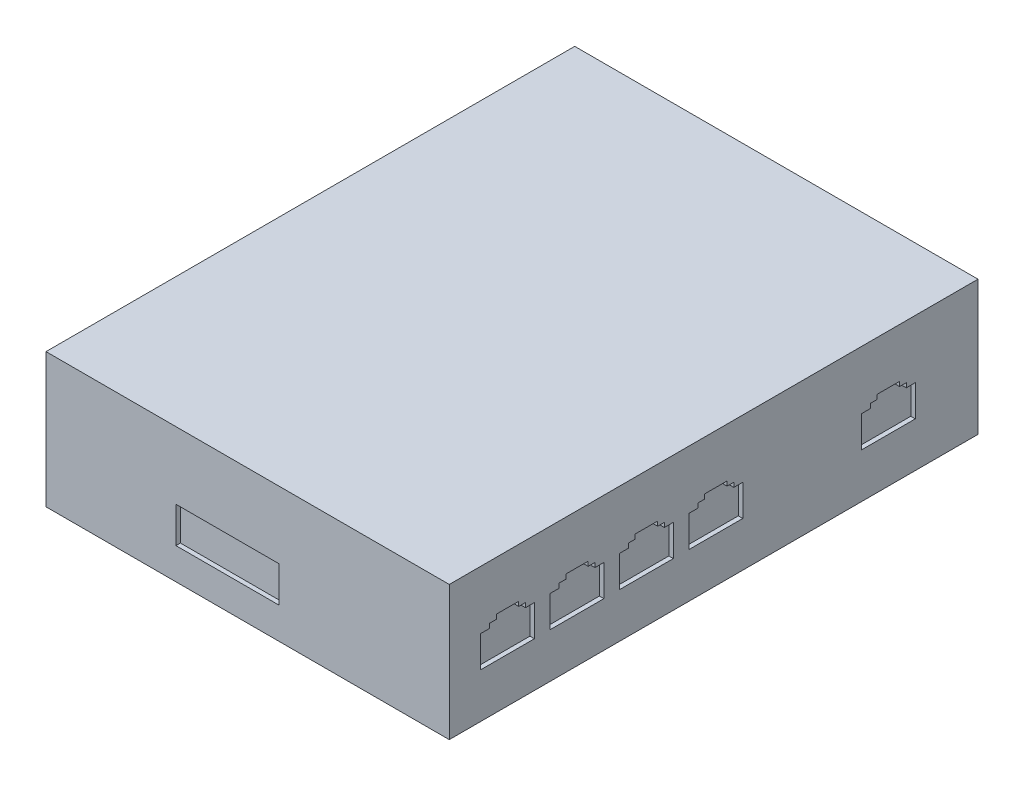
from build123d import *

# Parameters (mm, degrees)
SKETCH_1_W             = 90
SKETCH_1_H             = 118
EXTRUDE_1_DEPTH        = 30
HOLE_WIZARD_M3_1_D     = 2.5
HOLE_WIZARD_M3_1_DEPTH = 5
HOLE_WIZARD_M3_1_TIP   = 0.751075774
SKETCH_5_W             = 23
SKETCH_5_H             = 8
CUT_EXTRUDE_1_DEPTH    = 1
CUT_EXTRUDE_2_DEPTH    = 1


with BuildPart() as part:
    # 草图1 → 凸台-拉伸1 (new body)
    with BuildSketch(Plane(origin=(0, 0, 0), x_dir=(1, 0, 0), z_dir=(0, 1, 0))):
        Rectangle(SKETCH_1_W, SKETCH_1_H)
    extrude(amount=EXTRUDE_1_DEPTH)

    # M3 螺纹孔的螺纹孔钻头1
    with Locations(Plane.ZY.offset(45)):
        with Locations((10, 15), (-10, 15)):
            Hole(HOLE_WIZARD_M3_1_D / 2, depth=HOLE_WIZARD_M3_1_DEPTH)
            with Locations((0, 0, -(HOLE_WIZARD_M3_1_DEPTH + HOLE_WIZARD_M3_1_TIP / 2))):  # 118° drill point
                Cone(0, HOLE_WIZARD_M3_1_D / 2, HOLE_WIZARD_M3_1_TIP, mode=Mode.SUBTRACT)

    # 草图5 → 切除-拉伸1 (cut)
    with BuildSketch(Plane.XY.offset(59)):
        with Locations((-4.5, 11)):
            Rectangle(SKETCH_5_W, SKETCH_5_H)
    extrude(amount=-CUT_EXTRUDE_1_DEPTH, mode=Mode.SUBTRACT)

    # 草图6 → 切除-拉伸2 (cut)
    with BuildSketch(Plane(origin=(45, 0, 0), x_dir=(0, 0, -1), z_dir=(1, 0, 0))):
        Polygon((-40, 10), (-52, 10), (-52, 17), (-50, 17), (-50, 18), (-48.5, 18), (-48.5, 19), (-43.5, 19), (-43.5, 18), (-42, 18), (-42, 17), (-40, 17), align=None)
        Polygon((-24.5, 10), (-36.5, 10), (-36.5, 17), (-34.5, 17), (-34.5, 18), (-33, 18), (-33, 19), (-28, 19), (-28, 18), (-26.5, 18), (-26.5, 17), (-24.5, 17), align=None)
        Polygon((-9, 10), (-21, 10), (-21, 17), (-19, 17), (-19, 18), (-17.5, 18), (-17.5, 19), (-12.5, 19), (-12.5, 18), (-11, 18), (-11, 17), (-9, 17), align=None)
        Polygon((6.5, 10), (-5.5, 10), (-5.5, 17), (-3.5, 17), (-3.5, 18), (-2, 18), (-2, 19), (3, 19), (3, 18), (4.5, 18), (4.5, 17), (6.5, 17), align=None)
        Polygon((33, 10), (33, 17), (35, 17), (35, 18), (36.5, 18), (36.5, 19), (41.5, 19), (41.5, 18), (43, 18), (43, 17), (45, 17), (45, 10), align=None)
    extrude(amount=-CUT_EXTRUDE_2_DEPTH, mode=Mode.SUBTRACT)


solid = part.part
